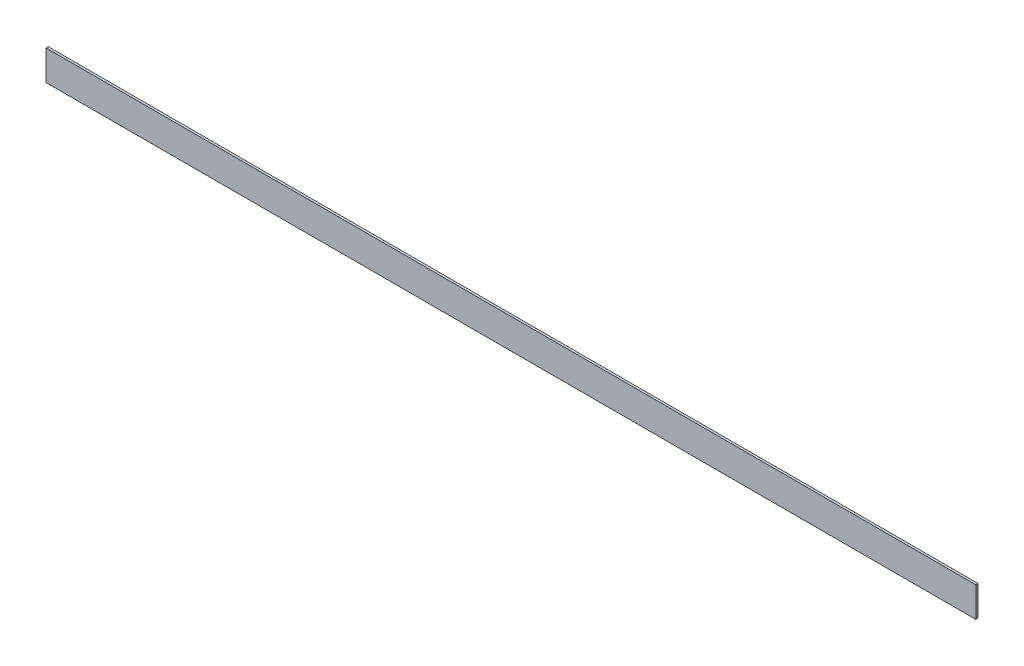
from build123d import *

# Parameters (mm, degrees)
PRESS_TEPSI_RAFI_RAF_BUK_ARKA_1_START = -798.5
SKETCH1_W                             = 620
SKETCH1_H                             = 20
PRESS_TEPSI_RAFI_RAF_BUK_ARKA_1_DEPTH = 1.5


with BuildPart() as part:
    # Sketch1 → PRESS_tepsi_rafi_raf_buk_arka_1 (new body)
    with BuildSketch(Plane.XY.offset(PRESS_TEPSI_RAFI_RAF_BUK_ARKA_1_START)):
        with Locations((350, 1062)):
            Rectangle(SKETCH1_W, SKETCH1_H)
    extrude(amount=-PRESS_TEPSI_RAFI_RAF_BUK_ARKA_1_DEPTH)


solid = part.part
